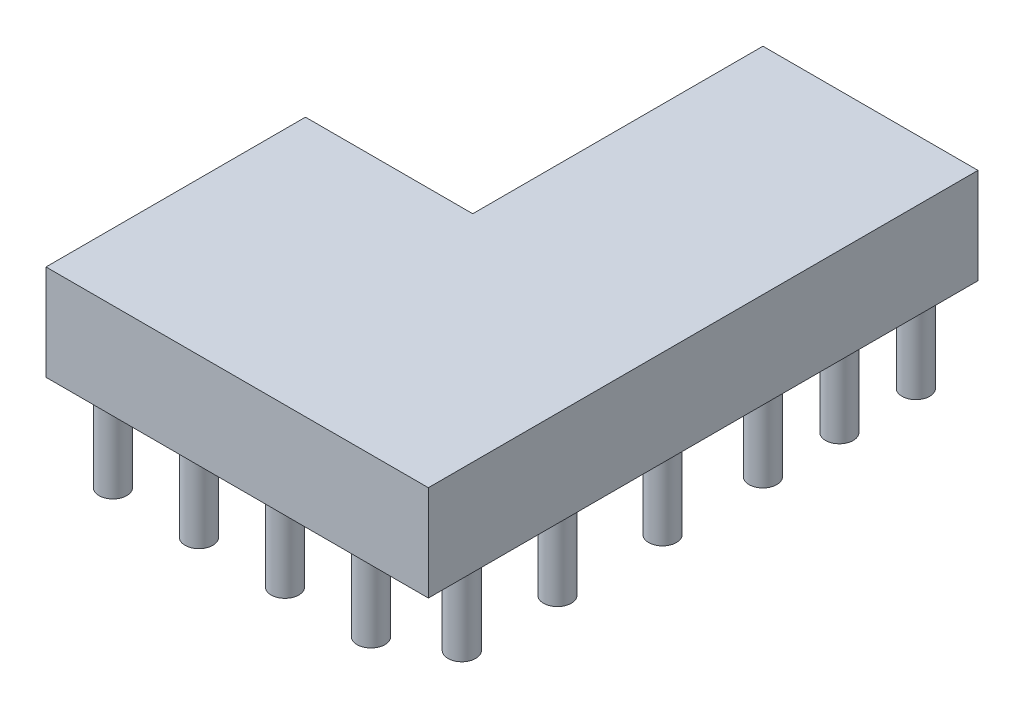
from build123d import *

# Parameters (mm, degrees)
EXTRUDE_1_DEPTH = 20
EXTRUDE_2_DEPTH = 9
SKETCH_4_R      = 2.9
EXTRUDE_3_DEPTH = 18


with BuildPart() as part:
    # Эскиз2 → Бобышка-Вытянуть1 (new body)
    with BuildSketch(Plane(origin=(0, 0, 0), x_dir=(1, 0, 0), z_dir=(0, 1, 0))):
        Polygon((-30.778265169, -2.685665469), (-4.786347208, -2.685665469), (-4.786347208, 58.028620245), (40.213652792, 58.028620245), (40.213652792, -56.971379755), (-39.786347208, -56.971379755), (-39.786347208, -2.685665469), align=None)
        Polygon((-34.786347208, -46.971379755), (30.213652792, -46.971379755), (30.213652792, -6.971379755), (30.213652792, 53.028620245), (5.213652792, 53.028620245), (5.213652792, -12.685665469), (-34.786347208, -12.685665469), align=None, mode=Mode.SUBTRACT)
    extrude(amount=-EXTRUDE_1_DEPTH)

    # Эскиз3 → Бобышка-Вытянуть2 (add)
    with BuildSketch(Plane(origin=(0, 0, 0), x_dir=(1, 0, 0), z_dir=(0, 1, 0))):
        Polygon((5.213652792, 53.028620245), (30.213652792, 53.028620245), (30.213652792, -46.971379755), (-34.786347208, -46.971379755), (-34.786347208, -12.685665469), (5.213652792, -12.685665469), align=None)
    extrude(amount=-EXTRUDE_2_DEPTH)

    # Эскиз4 → Бобышка-Вытянуть3 (add)
    with BuildSketch(Plane.XZ.offset(20)):
        with Locations(Location((35.213652792, 24.971379755, 0), (0, 0, 90))):
            Circle(SKETCH_4_R)
        with Locations(Location((35.213652792, 2.971379755, 0), (0, 0, 90))):
            Circle(SKETCH_4_R)
        with Locations(Location((35.213652792, -18.028620245, 0), (0, 0, 90))):
            Circle(SKETCH_4_R)
        with Locations(Location((35.213652792, -34.028620245, 0), (0, 0, 90))):
            Circle(SKETCH_4_R)
        with Locations(Location((35.213652792, -50.028620245, 0), (0, 0, 90))):
            Circle(SKETCH_4_R)
        with Locations(Location((23.213652792, 51.971379755, 0), (0, 0, 90))):
            Circle(SKETCH_4_R)
        with Locations(Location((5.213652792, 51.971379755, 0), (0, 0, 90))):
            Circle(SKETCH_4_R)
        with Locations(Location((-12.786347208, 51.971379755, 0), (0, 0, 90))):
            Circle(SKETCH_4_R)
        with Locations(Location((-30.786347208, 51.971379755, 0), (0, 0, 90))):
            Circle(SKETCH_4_R)
        with Locations(Location((-28.786347208, 7.685665469, 0), (0, 0, 90))):
            Circle(SKETCH_4_R)
        with Locations(Location((-12.786347208, 7.685665469, 0), (0, 0, 90))):
            Circle(SKETCH_4_R)
        with Locations(Location((0.213652792, -52.314334531, 0), (0, 0, 90))):
            Circle(SKETCH_4_R)
        with Locations(Location((0.213652792, -34.314334531, 0), (0, 0, 90))):
            Circle(SKETCH_4_R)
        with Locations(Location((0.213652792, -16.314334531, 0), (0, 0, 90))):
            Circle(SKETCH_4_R)
        with Locations(Location((35.213652792, 44.971379755, 0), (0, 0, 90))):
            Circle(SKETCH_4_R)
        with Locations(Location((0.213652792, 7.685665469, 0), (0, 0, 90))):
            Circle(SKETCH_4_R)
    extrude(amount=EXTRUDE_3_DEPTH)


solid = part.part
